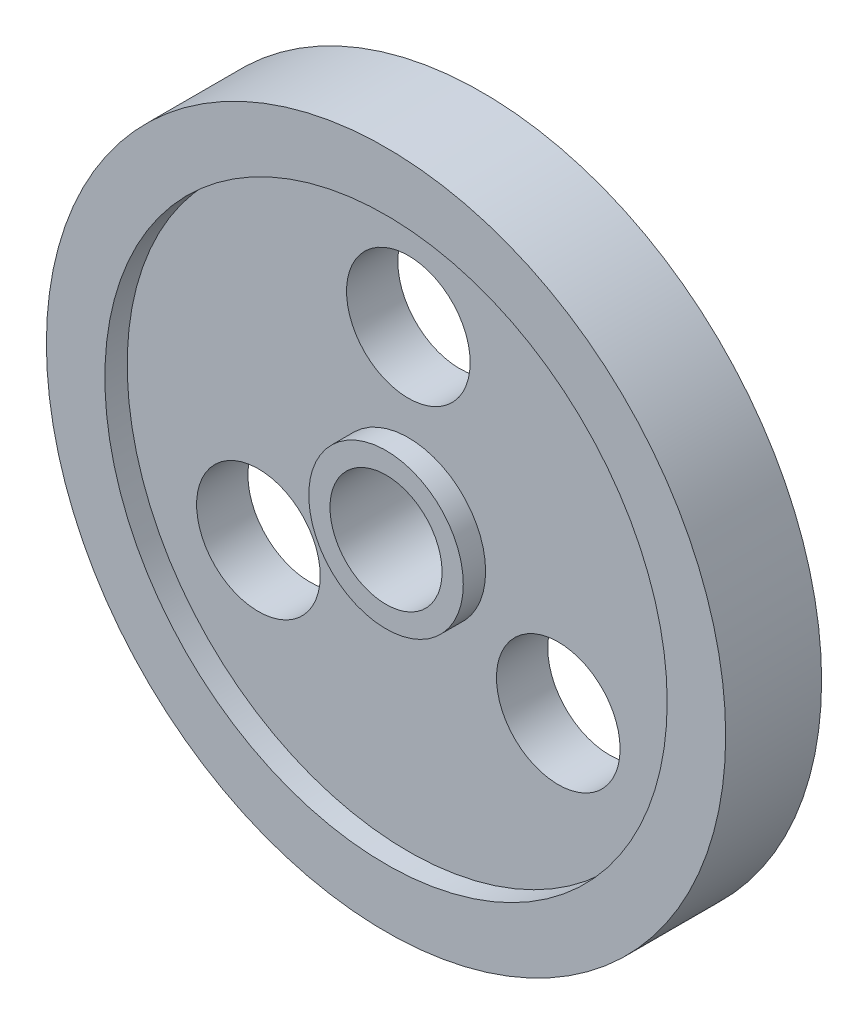
from build123d import *

# Parameters (mm, degrees)
SKETCH1_R           = 19.78095238
SKETCH1_R_2         = 3.2639
BOSS_EXTRUDE1_DEPTH = 2.794
SKETCH2_R           = 16.375
SKETCH2_R_2         = 4.5
CUT_EXTRUDE1_DEPTH  = 1.3
SKETCH3_R           = 3.600000039
CUT_EXTRUDE2_DEPTH  = 29.301220789


with BuildPart() as part:
    # Sketch1 → Boss-Extrude1 (new, symmetric)
    with BuildSketch(Plane.XY):
        Circle(SKETCH1_R)
        Circle(SKETCH1_R_2, mode=Mode.SUBTRACT)
    extrude(amount=BOSS_EXTRUDE1_DEPTH, both=True)

    # Sketch2 → Cut-Extrude1 (cut)
    with BuildSketch(Plane.XY.offset(2.794)):
        Circle(SKETCH2_R)
        Circle(SKETCH2_R_2, mode=Mode.SUBTRACT)
    cut_extrude1 = extrude(amount=-CUT_EXTRUDE1_DEPTH, mode=Mode.SUBTRACT)

    # Mirror1: Cut-Extrude1 across plane
    add(cut_extrude1.mirror(Plane.XY), mode=Mode.SUBTRACT)

    # Sketch3 → Cut-Extrude2 (cut, through all)
    with BuildSketch(Plane.XY.offset(1.494)):
        with Locations((0, 10.082498646)):
            Circle(SKETCH3_R)
        with Locations((8.731699961, -5.041249323)):
            Circle(SKETCH3_R)
        with Locations((-8.731699961, -5.041249323)):
            Circle(SKETCH3_R)
    extrude(amount=-CUT_EXTRUDE2_DEPTH, mode=Mode.SUBTRACT)


solid = part.part
